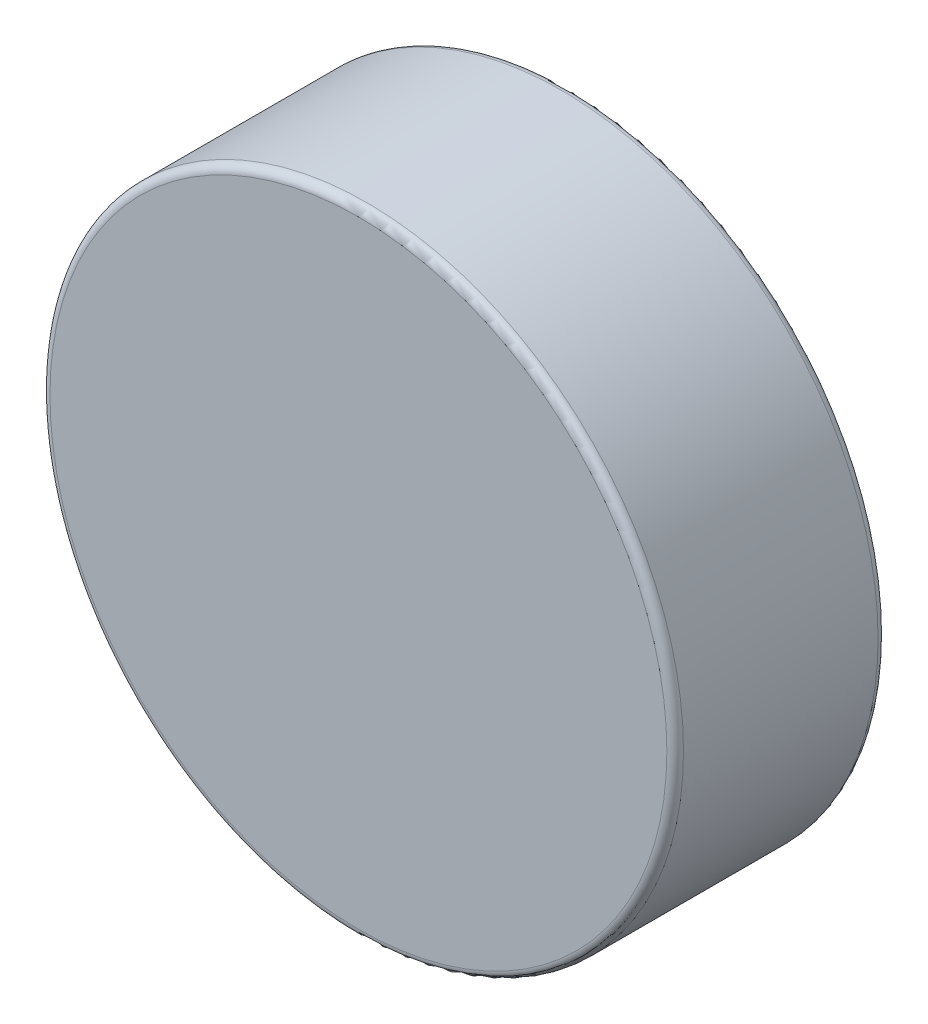
from build123d import *

# Parameters (mm, degrees)
ESQUISSE1_R        = 38.1
BOSS_EXTRU_1_DEPTH = 25.4
CONG_1_R           = 1


with BuildPart() as part:
    # Esquisse1 → Boss.-Extru.1 (new body)
    with BuildSketch(Plane.XY):
        Circle(ESQUISSE1_R)
    extrude(amount=BOSS_EXTRU_1_DEPTH)

    # Congé1
    cong_1_edges = [part.edges().sort_by_distance(p)[0] for p in [
        (-38.1, 0, 0),
        (-38.1, 0, 25.4),
    ]]
    fillet(cong_1_edges, radius=CONG_1_R)


solid = part.part
